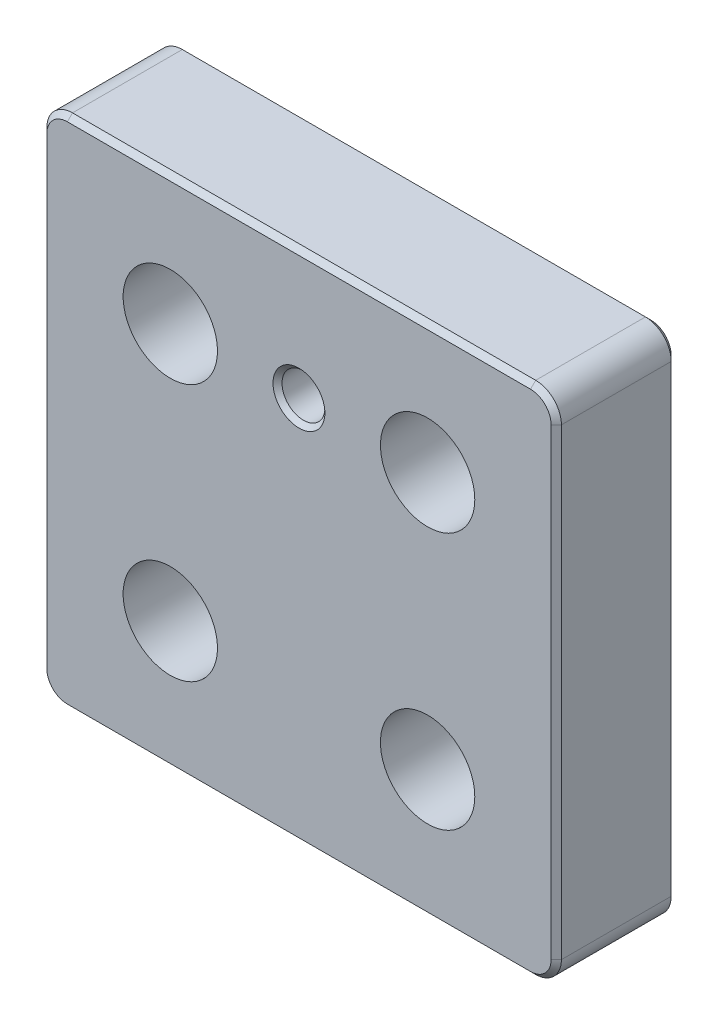
from build123d import *

# Parameters (mm, degrees)
SKETCH1_W                                           = 60
SKETCH1_H                                           = 60
BOSS_EXTRUDE1_DEPTH                                 = 14
CBORE_FOR_M6_HEX_SOCKET_HEAD_CAP_SCREW1_D           = 6.5
CBORE_FOR_M6_HEX_SOCKET_HEAD_CAP_SCREW1_CBORE_D     = 11
CBORE_FOR_M6_HEX_SOCKET_HEAD_CAP_SCREW1_CBORE_DEPTH = 8
M6_TAPPED_HOLE1_D                                   = 5
M6_TAPPED_HOLE1_CSINK_D                             = 6.05
M6_TAPPED_HOLE1_CSINK_ANGLE                         = 90
FILLET1_R                                           = 3
CHAMFER1_SIZE                                       = 0.6


with BuildPart() as part:
    # Sketch1 → Boss-Extrude1 (new body)
    with BuildSketch(Plane.XY):
        Rectangle(SKETCH1_W, SKETCH1_H)
    extrude(amount=BOSS_EXTRUDE1_DEPTH)

    # CBORE for M6 Hex Socket Head Cap Screw1 (through all)
    with Locations(Plane.XY.offset(14)):
        with Locations((-15, 15), (15, 15), (15, -15), (-15, -15)):
            CounterBoreHole(CBORE_FOR_M6_HEX_SOCKET_HEAD_CAP_SCREW1_D / 2, CBORE_FOR_M6_HEX_SOCKET_HEAD_CAP_SCREW1_CBORE_D / 2, CBORE_FOR_M6_HEX_SOCKET_HEAD_CAP_SCREW1_CBORE_DEPTH)

    # M6 Tapped Hole1 (through all)
    with Locations(Plane.XY.offset(14)):
        with Locations((0, 15)):
            CounterSinkHole(M6_TAPPED_HOLE1_D / 2, M6_TAPPED_HOLE1_CSINK_D / 2, counter_sink_angle=M6_TAPPED_HOLE1_CSINK_ANGLE)

    # Fillet1
    fillet1_edges = [part.edges().sort_by_distance(p)[0] for p in [
        (-30, 30, 7),
        (30, 30, 7),
        (30, -30, 7),
        (-30, -30, 7),
    ]]
    fillet(fillet1_edges, radius=FILLET1_R)

    # Chamfer1
    chamfer1_edges = [part.edges().sort_by_distance(p)[0] for p in [
        (-30, 0, 0),
        (-30, 0, 14),
        (0, 30, 0),
        (30, 0, 0),
        (0, -30, 0),
        (-29.121320344, -29.121320344, 0),
        (29.121320344, -29.121320344, 0),
        (29.121320344, 29.121320344, 0),
        (-29.121320344, 29.121320344, 0),
        (0, 30, 14),
        (0, -30, 14),
        (30, 0, 14),
        (-29.121320344, -29.121320344, 14),
        (29.121320344, -29.121320344, 14),
        (29.121320344, 29.121320344, 14),
        (-29.121320344, 29.121320344, 14),
    ]]
    chamfer(chamfer1_edges, length=CHAMFER1_SIZE)


solid = part.part
